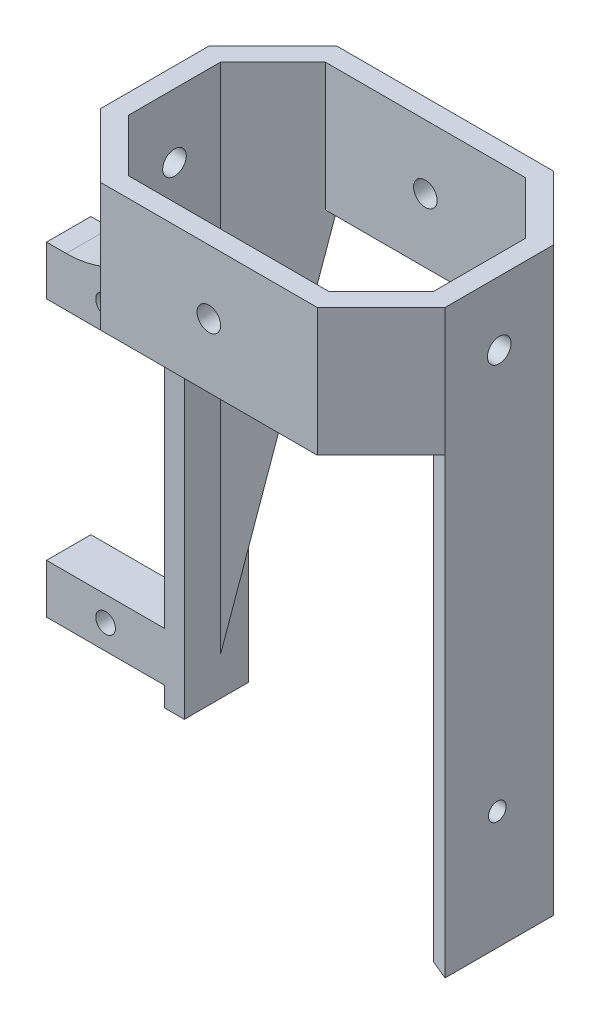
from build123d import *

# Parameters (mm, degrees)
BOSS_EXTRUDE1_DEPTH = 13
BOSS_EXTRUDE2_DEPTH = 46
SKETCH8_R           = 0.9
CUT_EXTRUDE1_DEPTH  = 10
SKETCH9_R           = 1.2
CUT_EXTRUDE2_DEPTH  = 40
SKETCH10_R          = 1.2
CUT_EXTRUDE3_DEPTH  = 50
BOSS_EXTRUDE3_DEPTH = 43
SKETCH12_W          = 4.508561795
SKETCH12_H          = 5
BOSS_EXTRUDE4_DEPTH = 12
SKETCH14_R          = 1
CUT_EXTRUDE4_DEPTH  = 30
BOSS_EXTRUDE5_DEPTH = 2
FILLET3_R           = 10
BOSS_EXTRUDE6_DEPTH = 46
SKETCH8_2_R         = 0.9
CUT_EXTRUDE5_DEPTH  = 30


with BuildPart() as part:
    # Sketch1 → Boss-Extrude1 (new body)
    with BuildSketch(Plane(origin=(0, 0, 0), x_dir=(1, 0, 0), z_dir=(0, 1, 0))):
        Polygon((-7.31986533, -4.491438205), (-0.828427125, 2), (21.188696525, 2), (27.68013467, -4.491438145), (27.68013467, -15.508561795), (21.188696464, -22), (-0.828427125, -22), (-7.31986533, -15.508561795), align=None)
        Polygon((0, 0), (20.3602694, 0), (25.68013467, -5.31986527), (25.68013467, -14.68013467), (20.36026934, -20), (0, -20), (-5.31986533, -14.68013467), (-5.31986533, -5.31986533), align=None, mode=Mode.SUBTRACT)
    extrude(amount=BOSS_EXTRUDE1_DEPTH)

    # Sketch7 → Boss-Extrude2 (add)
    with BuildSketch(Plane.XZ):
        with BuildLine():
            ThreePointArc((27.68013467, 12.696190421), (26.68013467, 13.696190421), (25.68013467, 12.696190421))
            Line((25.68013467, 12.696190421), (25.68013467, 7.303809579))
            ThreePointArc((25.68013467, 7.303809579), (26.68013467, 6.303809579), (27.68013467, 7.303809579))
            Line((27.68013467, 7.303809579), (27.68013467, 12.696190421))
        make_face()
    extrude(amount=BOSS_EXTRUDE2_DEPTH)

    # Sketch8 → Cut-Extrude1 (cut)
    with BuildSketch(Plane(origin=(27.68013467, 0, 0), x_dir=(0, 0, -1), z_dir=(1, 0, 0))):
        with Locations((-10.196190421, -34)):
            Circle(SKETCH8_R)
    extrude(amount=-CUT_EXTRUDE1_DEPTH, mode=Mode.SUBTRACT)

    # Sketch9 → Cut-Extrude2 (cut)
    with BuildSketch(Plane.XY.offset(22)):
        with Locations((10.171572875, 6.5)):
            Circle(SKETCH9_R)
    extrude(amount=-CUT_EXTRUDE2_DEPTH, mode=Mode.SUBTRACT)

    # Sketch10 → Cut-Extrude3 (cut)
    with BuildSketch(Plane(origin=(27.68013467, 0, 0), x_dir=(0, 0, -1), z_dir=(1, 0, 0))):
        with Locations((-10, 6.5)):
            Circle(SKETCH10_R)
    extrude(amount=-CUT_EXTRUDE3_DEPTH, mode=Mode.SUBTRACT)

    # Sketch11 → Boss-Extrude3 (add)
    with BuildSketch(Plane.XZ):
        Polygon((-5.31986533, 9), (-7.31986533, 9), (-7.31986533, 4.491438205), (-5.31986533, 2.491438205), align=None)
    extrude(amount=BOSS_EXTRUDE3_DEPTH)

    # Sketch12 → Boss-Extrude4 (add)
    with BuildSketch(Plane.ZY.offset(7.31986533)):
        with Locations((6.745719103, -10.5)):
            Rectangle(SKETCH12_W, SKETCH12_H)
        with Locations((6.745719103, -38.5)):
            Rectangle(SKETCH12_W, SKETCH12_H)
    extrude(amount=BOSS_EXTRUDE4_DEPTH)

    # Sketch14 → Cut-Extrude4 (cut)
    with BuildSketch(Plane.XY.offset(9)):
        with Locations((-13.31986532, -10.5)):
            Circle(SKETCH14_R)
        with Locations((-13.31986532, -38.5)):
            Circle(SKETCH14_R)
    extrude(amount=-CUT_EXTRUDE4_DEPTH, mode=Mode.SUBTRACT)

    # Sketch17 → Boss-Extrude5 (add)
    with BuildSketch(Plane(origin=(-1.414213562, 0, -1.414213562), x_dir=(-0.7071067811865714, 0, 0.7071067811865236), z_dir=(-0.7071067811865236, 0, -0.7071067811865714))):
        Polygon((-0.828427125, 0), (8.351852825, -43), (8.351852825, 0), align=None)
    extrude(amount=-BOSS_EXTRUDE5_DEPTH)

    # Fillet3
    fillet3_edges = [part.edges().sort_by_distance(p)[0] for p in [
        (-7.31986533, -8, 6.745719103),
    ]]
    fillet(fillet3_edges, radius=FILLET3_R)

    # Sketch18 → Boss-Extrude6 (add)
    with BuildSketch(Plane.XZ):
        Polygon((27.68013467, 15.508561795), (25.68013467, 14.68013467), (25.68013467, 5.31986527), (27.68013467, 4.491438145), align=None)
    extrude(amount=BOSS_EXTRUDE6_DEPTH)

    # Sketch8<2> → Cut-Extrude5 (cut)
    with BuildSketch(Plane(origin=(27.68013467, 0, 0), x_dir=(0, 0, -1), z_dir=(1, 0, 0))):
        with Locations((-10.196190421, -34)):
            Circle(SKETCH8_2_R)
    extrude(amount=-CUT_EXTRUDE5_DEPTH, mode=Mode.SUBTRACT)


solid = part.part
